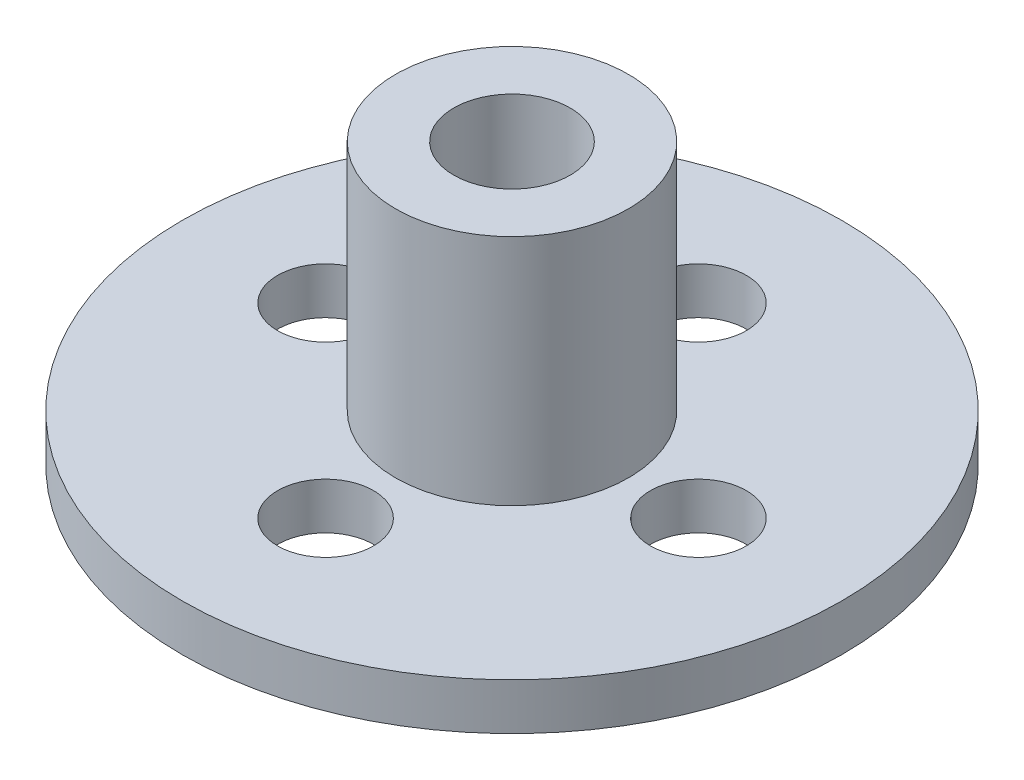
from build123d import *

# Parameters (mm, degrees)
SKETCH_1_R      = 14.149308539
SKETCH_1_R_2    = 2.058081242
EXTRUDE_1_DEPTH = 2
SKETCH_2_R      = 5
SKETCH_2_R_2    = 2.5
EXTRUDE_2_DEPTH = 10


with BuildPart() as part:
    # 草图1 → 凸台-拉伸1 (new body)
    with BuildSketch(Plane(origin=(0, 0, 0), x_dir=(1, 0, 0), z_dir=(0, 1, 0))):
        with Locations(Location((0, 0, 0), (0, 0, 270))):
            Circle(SKETCH_1_R)
        with Locations(Location((0, 8, 0), (0, 0, 270))):
            Circle(SKETCH_1_R_2, mode=Mode.SUBTRACT)
        with Locations(Location((-8, 0, 0), (0, 0, 270))):
            Circle(SKETCH_1_R_2, mode=Mode.SUBTRACT)
        with Locations(Location((0, -8, 0), (0, 0, 270))):
            Circle(SKETCH_1_R_2, mode=Mode.SUBTRACT)
        with Locations(Location((8, 0, 0), (0, 0, 270))):
            Circle(SKETCH_1_R_2, mode=Mode.SUBTRACT)
    extrude(amount=EXTRUDE_1_DEPTH)

    # 草图2 → 凸台-拉伸2 (add)
    with BuildSketch(Plane(origin=(0, 2, 0), x_dir=(1, 0, 0), z_dir=(0, 1, 0))):
        with Locations(Location((0, 0, 0), (0, 0, 270))):
            Circle(SKETCH_2_R)
        with Locations(Location((0, 0, 0), (0, 0, 270))):
            Circle(SKETCH_2_R_2, mode=Mode.SUBTRACT)
    extrude(amount=EXTRUDE_2_DEPTH)


solid = part.part
